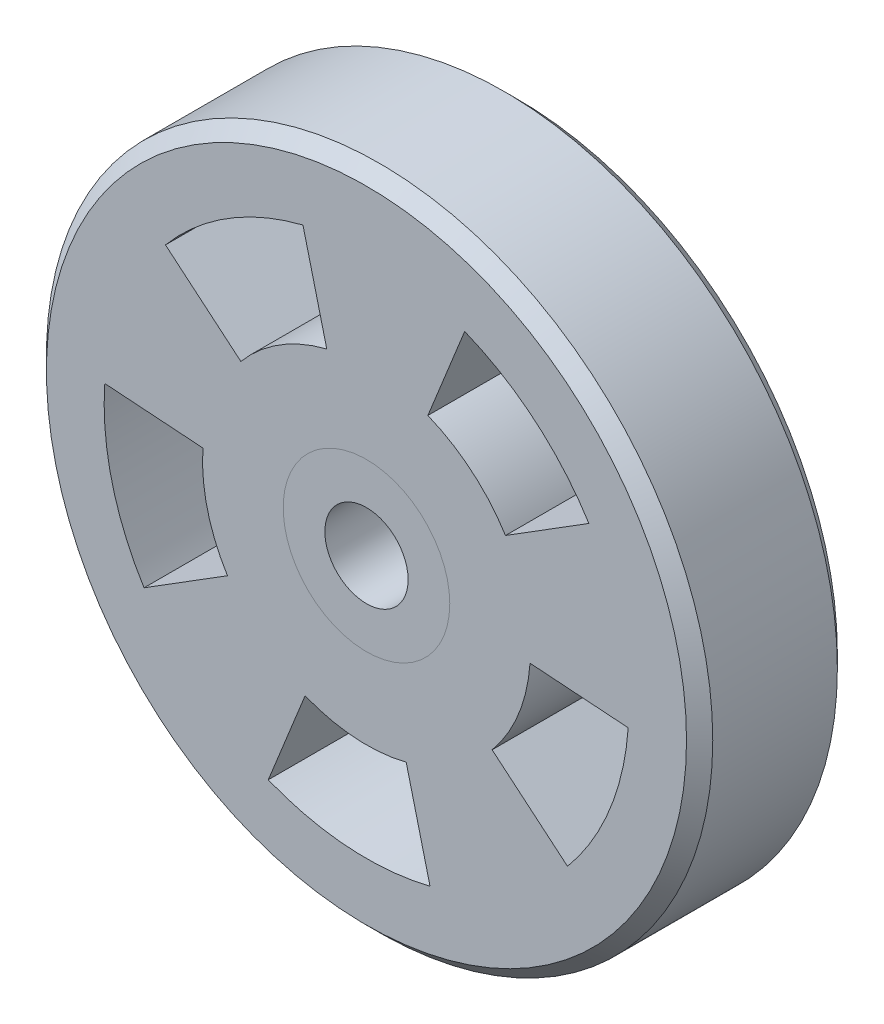
from build123d import *

# Parameters (mm, degrees)
SKETCH1_R           = 50.8
SKETCH1_R_2         = 12.7
BOSS_EXTRUDE1_DEPTH = 23
CHAMFER1_SIZE       = 2
SKETCH3_R           = 12.7
SKETCH3_R_2         = 6.35
BOSS_EXTRUDE3_DEPTH = 23


with BuildPart() as part:
    # Sketch1 → Boss-Extrude1 (new body)
    with BuildSketch(Plane.XY):
        Circle(SKETCH1_R)
        Circle(SKETCH1_R_2, mode=Mode.SUBTRACT)
        with BuildLine():
            ThreePointArc((-14.973462877, -37.091716184), (-2.77863879, -39.903372871), (9.688177823, -38.809009398))
            Line((9.688177823, -38.809009398), (6.055111139, -24.255630874))
            ThreePointArc((6.055111139, -24.255630874), (-1.736649244, -24.939608044), (-9.358414298, -23.182322615))
            Line((-9.358414298, -23.182322615), (-14.973462877, -37.091716184))
        make_face(mode=Mode.SUBTRACT)
        with BuildLine():
            ThreePointArc((30.649263883, -25.702580092), (37.091716184, -14.973462877), (39.903372871, -2.77863879))
            Line((39.903372871, -2.77863879), (24.939608044, -1.736649244))
            ThreePointArc((24.939608044, -1.736649244), (23.182322615, -9.358414298), (19.155789927, -16.064112558))
            Line((19.155789927, -16.064112558), (30.649263883, -25.702580092))
        make_face(mode=Mode.SUBTRACT)
        with BuildLine():
            ThreePointArc((33.915749687, 21.206648088), (25.702580092, 30.649263883), (14.973462877, 37.091716184))
            Line((14.973462877, 37.091716184), (9.358414298, 23.182322615))
            ThreePointArc((9.358414298, 23.182322615), (16.064112558, 19.155789927), (21.197343555, 13.254155055))
            Line((21.197343555, 13.254155055), (33.915749687, 21.206648088))
        make_face(mode=Mode.SUBTRACT)
        with BuildLine():
            ThreePointArc((-9.688177823, 38.809009398), (-21.206648088, 33.915749687), (-30.649263883, 25.702580092))
            Line((-30.649263883, 25.702580092), (-19.155789927, 16.064112558))
            ThreePointArc((-19.155789927, 16.064112558), (-13.254155055, 21.197343555), (-6.055111139, 24.255630874))
            Line((-6.055111139, 24.255630874), (-9.688177823, 38.809009398))
        make_face(mode=Mode.SUBTRACT)
        with BuildLine():
            ThreePointArc((-39.903372871, 2.77863879), (-38.809009398, -9.688177823), (-33.915749687, -21.206648088))
            Line((-33.915749687, -21.206648088), (-21.197343555, -13.254155055))
            ThreePointArc((-21.197343555, -13.254155055), (-24.255630874, -6.055111139), (-24.939608044, 1.736649244))
            Line((-24.939608044, 1.736649244), (-39.903372871, 2.77863879))
        make_face(mode=Mode.SUBTRACT)
    extrude(amount=BOSS_EXTRUDE1_DEPTH)

    # Chamfer1
    chamfer1_edges = [part.edges().sort_by_distance(p)[0] for p in [
        (-50.8, 0, 23),
        (-50.8, 0, 0),
    ]]
    chamfer(chamfer1_edges, length=CHAMFER1_SIZE)


with BuildPart() as body_2:
    # Sketch3 → Boss-Extrude3 (new body)
    with BuildSketch(Plane.XY.offset(23)):
        Circle(SKETCH3_R)
        Circle(SKETCH3_R_2, mode=Mode.SUBTRACT)
    extrude(amount=-BOSS_EXTRUDE3_DEPTH)


solid = Compound([part.part, body_2.part])
